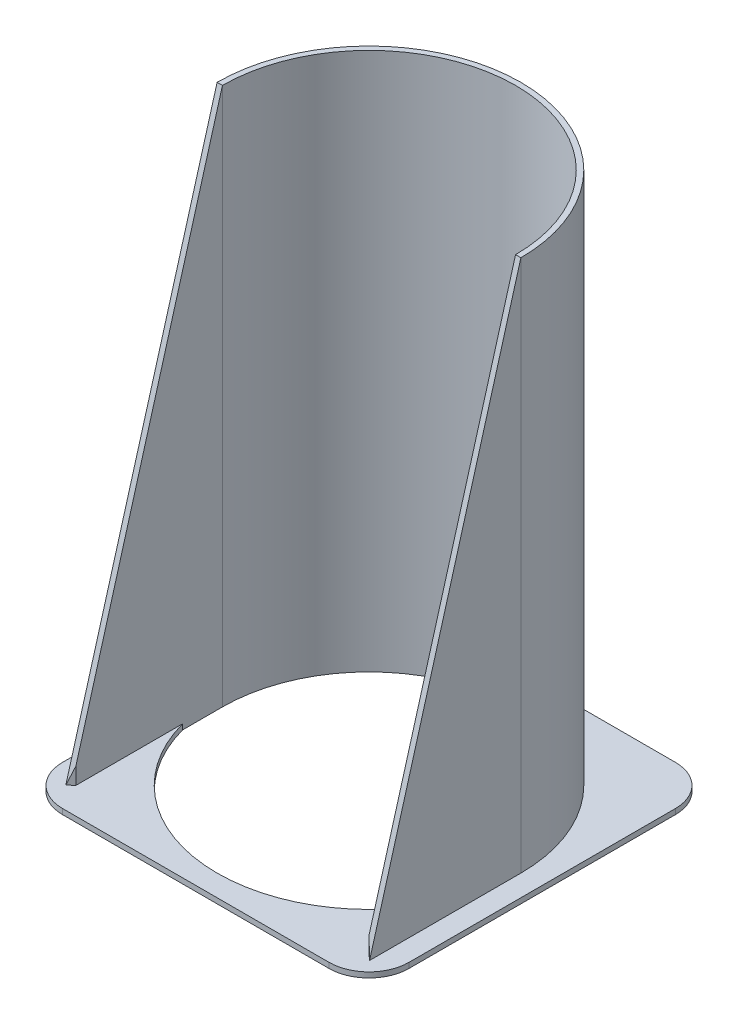
from build123d import *

# Parameters (mm, degrees)
ESQUISSE1_W             = 65
ESQUISSE1_H             = 65
BOSS_EXTRU_1_DEPTH      = 1
BOSS_EXTRU_2_START      = 1
BOSS_EXTRU_2_DEPTH      = 100
ENL_V_MAT_EXTRU_1_REACH = 161.619
CONG_1_R                = 7.5


with BuildPart() as part:
    # Esquisse1 → Boss.-Extru.1 (new body)
    with BuildSketch(Plane(origin=(0, 0, 0), x_dir=(1, 0, 0), z_dir=(0, 1, 0))):
        with Locations((75, 75)):
            Rectangle(ESQUISSE1_W, ESQUISSE1_H)
        with BuildLine():
            Line((47.5, 67.516685226), (47.5, 75))
            ThreePointArc((47.5, 75), (75, 102.5), (102.5, 75))
            Line((102.5, 75), (102.5, 67.516685226))
            ThreePointArc((102.5, 67.516685226), (75, 46.5), (47.5, 67.516685226))
        make_face(mode=Mode.SUBTRACT)
    extrude(amount=BOSS_EXTRU_1_DEPTH)

    # Esquisse1<3> → Boss.-Extru.2 (add)
    with BuildSketch(Plane(origin=(0, 0, 0), x_dir=(1, 0, 0), z_dir=(0, 1, 0)).offset(BOSS_EXTRU_2_START)):
        with BuildLine():
            ThreePointArc((103.5, 75), (75, 103.5), (46.5, 75))
            Line((46.5, 75), (46.5, 46.608370242))
            Line((46.5, 46.608370242), (47.5, 47.5))
            Line((47.5, 47.5), (47.5, 67.516685226))
            Line((47.5, 67.516685226), (47.5, 75))
            ThreePointArc((47.5, 75), (75, 102.5), (102.5, 75))
            Line((102.5, 75), (102.5, 67.516685226))
            Line((102.5, 67.516685226), (102.5, 47.5))
            Line((102.5, 47.5), (103.5, 46.608370242))
            Line((103.5, 46.608370242), (103.5, 75))
        make_face()
    extrude(amount=BOSS_EXTRU_2_DEPTH)

    # Enlèv. mat.-Extru.1: up to this face of the body (flat: up to its plane)
    enl_v_mat_extru_1_end = Plane(part.part.faces().sort_by_distance((103.5, 51, -60.804185121))[0])
    # Esquisse2 → Enlèv. mat.-Extru.1 (cut, up to the picked face)
    with BuildSketch(Plane.ZY.offset(-46.5), mode=Mode.PRIVATE) as enl_v_mat_extru_1_sk1:
        Polygon((-46.608370242, 1), (-75, 101), (-46.608370242, 101), align=None)
    enl_v_mat_extru_1_tool1 = split(extrude(enl_v_mat_extru_1_sk1.sketch, amount=-ENL_V_MAT_EXTRU_1_REACH, mode=Mode.PRIVATE), bisect_by=enl_v_mat_extru_1_end, keep=Keep.BOTH, mode=Mode.PRIVATE)
    add(enl_v_mat_extru_1_tool1.solids().sort_by(Axis((46.5, 67.666667, -56.072247), (1, 0, 0)))[0], mode=Mode.SUBTRACT)

    # Congé1
    cong_1_edges = [part.edges().sort_by_distance(p)[0] for p in [
        (42.5, 0.5, -42.5),
        (42.5, 0.5, -107.5),
        (107.5, 0.5, -107.5),
        (107.5, 0.5, -42.5),
    ]]
    fillet(cong_1_edges, radius=CONG_1_R)


solid = part.part
